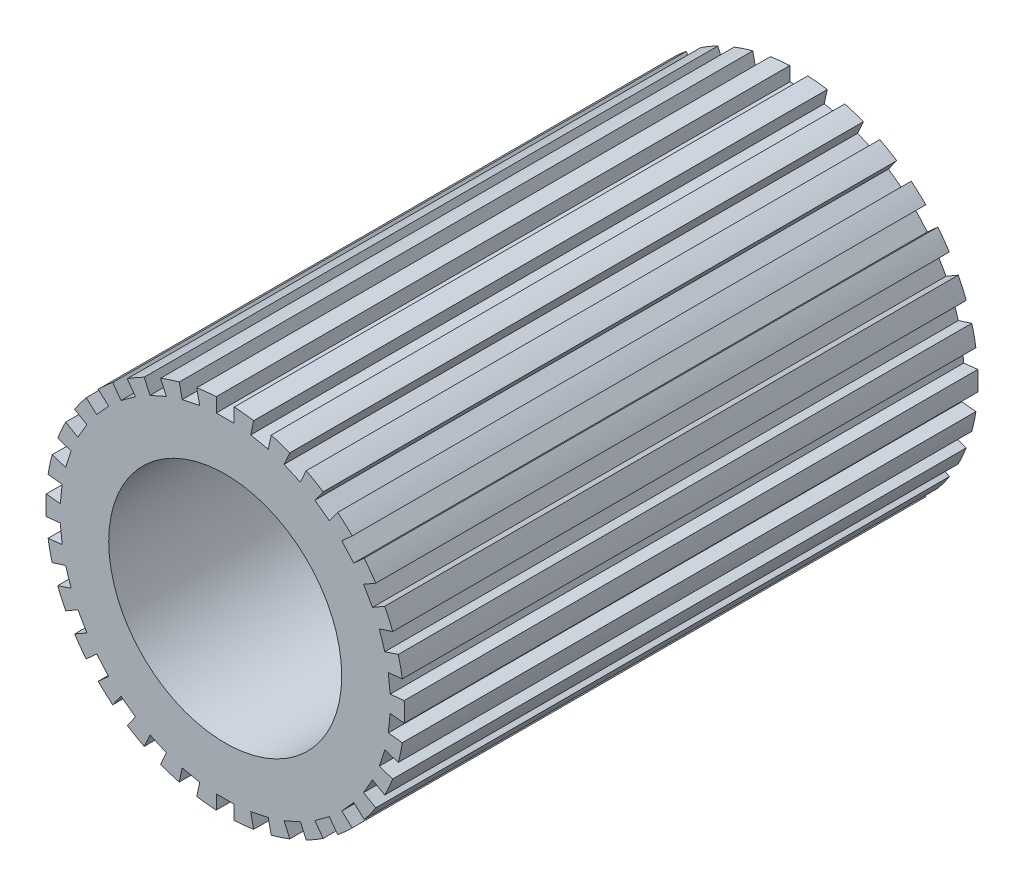
from build123d import *

# Parameters (mm, degrees)
SKETCH1_R           = 2.5
SKETCH1_R_2         = 1.625
BOSS_EXTRUDE1_DEPTH = 4
BOSS_EXTRUDE2_START = -4
SKETCH1_2_R         = 2.5
BOSS_EXTRUDE2_DEPTH = 4
SKETCH2_W           = 0.25
SKETCH2_H           = 1
CUT_EXTRUDE1_DEPTH  = 9.746427842


with BuildPart() as part:
    # Sketch1 → Boss-Extrude1 (new body)
    with BuildSketch(Plane.XY):
        Circle(SKETCH1_R)
        Circle(SKETCH1_R_2, mode=Mode.SUBTRACT)
    extrude(amount=BOSS_EXTRUDE1_DEPTH)

    # Sketch1<2> → Boss-Extrude2 (add)
    with BuildSketch(Plane.XY.offset(BOSS_EXTRUDE2_START)):
        Circle(SKETCH1_2_R)
    extrude(amount=BOSS_EXTRUDE2_DEPTH)

    # Sketch2 → Cut-Extrude1 (cut, through all)
    with BuildSketch(Plane.XY.offset(4)):
        Polygon((0.355928439, 2.275728443), (0.56384013, 3.253876044), (0.80837703, 3.201898121), (0.600465339, 2.22375052), align=None)
        with Locations((0, 2.8)):
            Rectangle(SKETCH2_W, SKETCH2_H)
        Polygon((0.821301097, 2.151996633), (1.22803774, 3.065542091), (1.456424104, 2.96385793), (1.049687461, 2.050312472), align=None)
        Polygon((1.250778956, 1.934212244), (1.838564208, 2.743229238), (2.040818457, 2.596282925), (1.453033205, 1.787265931), align=None)
        Polygon((1.625591773, 1.631893498), (2.368736598, 2.301024104), (2.53601925, 2.115237898), (1.792874424, 1.446107291), align=None)
        Polygon((1.929358429, 1.258253175), (2.795383832, 1.758253175), (2.920383832, 1.541746825), (2.054358429, 1.041746825), align=None)
        Polygon((2.148802863, 0.829621152), (3.099859379, 1.138638146), (3.177113628, 0.900874017), (2.226057112, 0.591857023), align=None)
        Polygon((2.274334301, 0.364730702), (3.268856197, 0.469259166), (3.294988313, 0.220628692), (2.300466417, 0.116100229), align=None)
        Polygon((2.300466417, -0.116100229), (3.294988313, -0.220628692), (3.268856197, -0.469259166), (2.274334301, -0.364730702), align=None)
        Polygon((2.226057112, -0.591857023), (3.177113628, -0.900874017), (3.099859379, -1.138638146), (2.148802863, -0.829621152), align=None)
        Polygon((2.054358429, -1.041746825), (2.920383832, -1.541746825), (2.795383832, -1.758253175), (1.929358429, -1.258253175), align=None)
        Polygon((1.792874424, -1.446107291), (2.53601925, -2.115237898), (2.368736598, -2.301024104), (1.625591773, -1.631893498), align=None)
        Polygon((1.453033205, -1.787265931), (2.040818457, -2.596282925), (1.838564208, -2.743229238), (1.250778956, -1.934212244), align=None)
        Polygon((1.049687461, -2.050312472), (1.456424104, -2.96385793), (1.22803774, -3.065542091), (0.821301097, -2.151996633), align=None)
        Polygon((0.600465339, -2.22375052), (0.80837703, -3.201898121), (0.56384013, -3.253876044), (0.355928439, -2.275728443), align=None)
        with Locations((0, -2.8)):
            Rectangle(SKETCH2_W, SKETCH2_H)
        Polygon((-0.355928439, -2.275728443), (-0.56384013, -3.253876044), (-0.80837703, -3.201898121), (-0.600465339, -2.22375052), align=None)
        Polygon((-0.821301097, -2.151996633), (-1.22803774, -3.065542091), (-1.456424104, -2.96385793), (-1.049687461, -2.050312472), align=None)
        Polygon((-1.250778956, -1.934212244), (-1.838564208, -2.743229238), (-2.040818457, -2.596282925), (-1.453033205, -1.787265931), align=None)
        Polygon((-1.625591773, -1.631893498), (-2.368736598, -2.301024104), (-2.53601925, -2.115237898), (-1.792874424, -1.446107291), align=None)
        Polygon((-1.929358429, -1.258253175), (-2.795383832, -1.758253175), (-2.920383832, -1.541746825), (-2.054358429, -1.041746825), align=None)
        Polygon((-2.148802863, -0.829621152), (-3.099859379, -1.138638146), (-3.177113628, -0.900874017), (-2.226057112, -0.591857023), align=None)
        Polygon((-2.274334301, -0.364730702), (-3.268856197, -0.469259166), (-3.294988313, -0.220628692), (-2.300466417, -0.116100229), align=None)
        Polygon((-2.300466417, 0.116100229), (-3.294988313, 0.220628692), (-3.268856197, 0.469259166), (-2.274334301, 0.364730702), align=None)
        Polygon((-2.226057112, 0.591857023), (-3.177113628, 0.900874017), (-3.099859379, 1.138638146), (-2.148802863, 0.829621152), align=None)
        Polygon((-2.054358429, 1.041746825), (-2.920383832, 1.541746825), (-2.795383832, 1.758253175), (-1.929358429, 1.258253175), align=None)
        Polygon((-1.792874424, 1.446107291), (-2.53601925, 2.115237898), (-2.368736598, 2.301024104), (-1.625591773, 1.631893498), align=None)
        Polygon((-1.453033205, 1.787265931), (-2.040818457, 2.596282925), (-1.838564208, 2.743229238), (-1.250778956, 1.934212244), align=None)
        Polygon((-1.049687461, 2.050312472), (-1.456424104, 2.96385793), (-1.22803774, 3.065542091), (-0.821301097, 2.151996633), align=None)
        Polygon((-0.600465339, 2.22375052), (-0.80837703, 3.201898121), (-0.56384013, 3.253876044), (-0.355928439, 2.275728443), align=None)
    extrude(amount=-CUT_EXTRUDE1_DEPTH, mode=Mode.SUBTRACT)


solid = part.part
